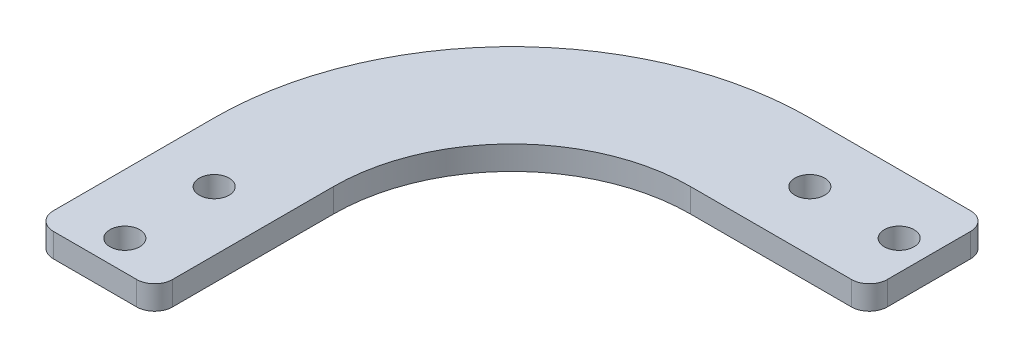
from build123d import *

# Parameters (mm, degrees)
SKETCH1_R           = 2.5
BOSS_EXTRUDE1_DEPTH = 4


with BuildPart() as part:
    # Sketch1 → Boss-Extrude1 (new body)
    with BuildSketch(Plane(origin=(0, 0, 0), x_dir=(1, 0, 0), z_dir=(0, 1, 0))):
        with BuildLine():
            Line((-50, 0), (-50, -27))
            ThreePointArc((-50, -27), (-49.121320344, -29.121320344), (-47, -30))
            Line((-47, -30), (-33, -30))
            ThreePointArc((-33, -30), (-30.878679656, -29.121320344), (-30, -27))
            Line((-30, -27), (-30, -14.142135624))
            Line((-30, -14.142135624), (-30, 0))
            ThreePointArc((-30, 0), (-21.213203436, 21.213203436), (0, 30))
            Line((0, 30), (14.142135624, 30))
            Line((14.142135624, 30), (27, 30))
            ThreePointArc((27, 30), (29.121320344, 30.878679656), (30, 33))
            Line((30, 33), (30, 47))
            ThreePointArc((30, 47), (29.121320344, 49.121320344), (27, 50))
            Line((27, 50), (0, 50))
            ThreePointArc((0, 50), (-35.355339059, 35.355339059), (-50, 0))
        make_face()
        with Locations(Location((-40, -10, 0), (0, 0, 270))):
            Circle(SKETCH1_R, mode=Mode.SUBTRACT)
        with Locations(Location((-40, -25, 0), (0, 0, 270))):
            Circle(SKETCH1_R, mode=Mode.SUBTRACT)
        with Locations(Location((10, 40, 0), (0, 0, 270))):
            Circle(SKETCH1_R, mode=Mode.SUBTRACT)
        with Locations(Location((25, 40, 0), (0, 0, 270))):
            Circle(SKETCH1_R, mode=Mode.SUBTRACT)
    extrude(amount=BOSS_EXTRUDE1_DEPTH)


solid = part.part
